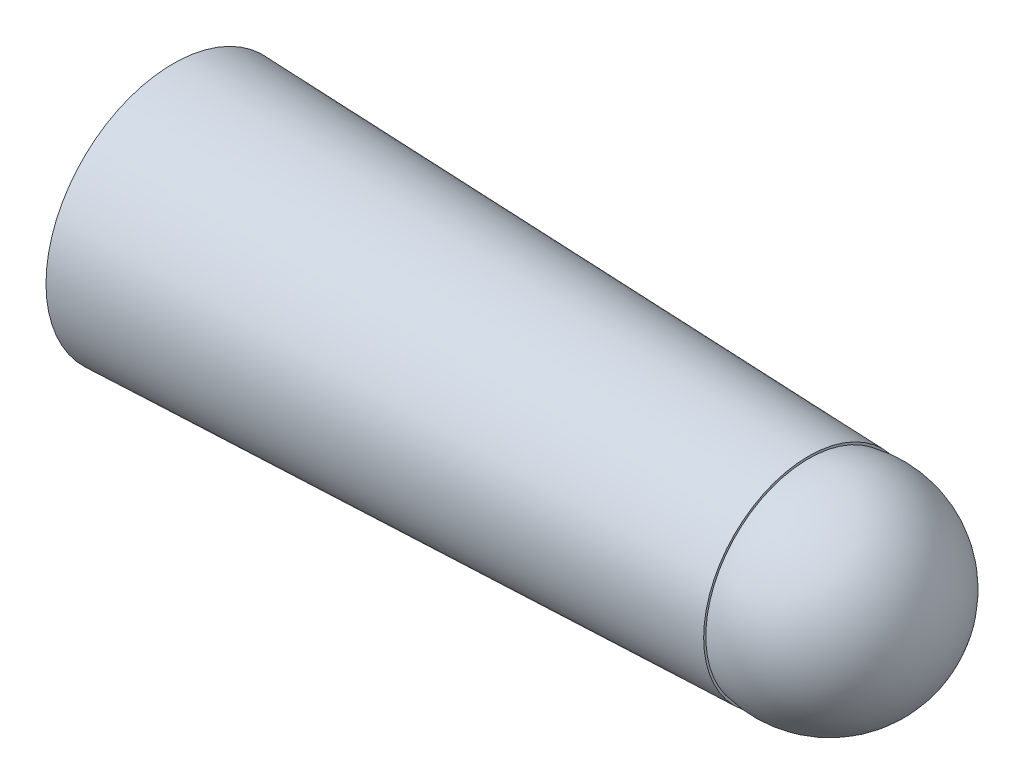
from build123d import *

# Parameters (mm, degrees)
SKETCH1_R           = 3
BOSS_EXTRUDE1_DEPTH = 15
BOSS_EXTRUDE1_TAPER = 2


with BuildPart() as part:
    # Sketch1 → Boss-Extrude1 (new body)
    with BuildSketch(Plane(origin=(0, 0, 0), x_dir=(0, 0, -1), z_dir=(1, 0, 0))):
        Circle(SKETCH1_R)
    extrude(amount=BOSS_EXTRUDE1_DEPTH, taper=BOSS_EXTRUDE1_TAPER)

    # Sketch2 → Revolve1 (revolve)
    with BuildSketch(Plane(origin=(15.5, 0, 0), x_dir=(0, 0, -1), z_dir=(1, 0, 0))):
        with BuildLine():
            Line((0, 2.476188458), (0, -2.476188458))
            ThreePointArc((0, -2.476188458), (2.476188458, 0), (0, 2.476188458))
        make_face()
    revolve(axis=Axis((15.5, 2.476188458, 0), (0, -1, 0)))


solid = part.part
